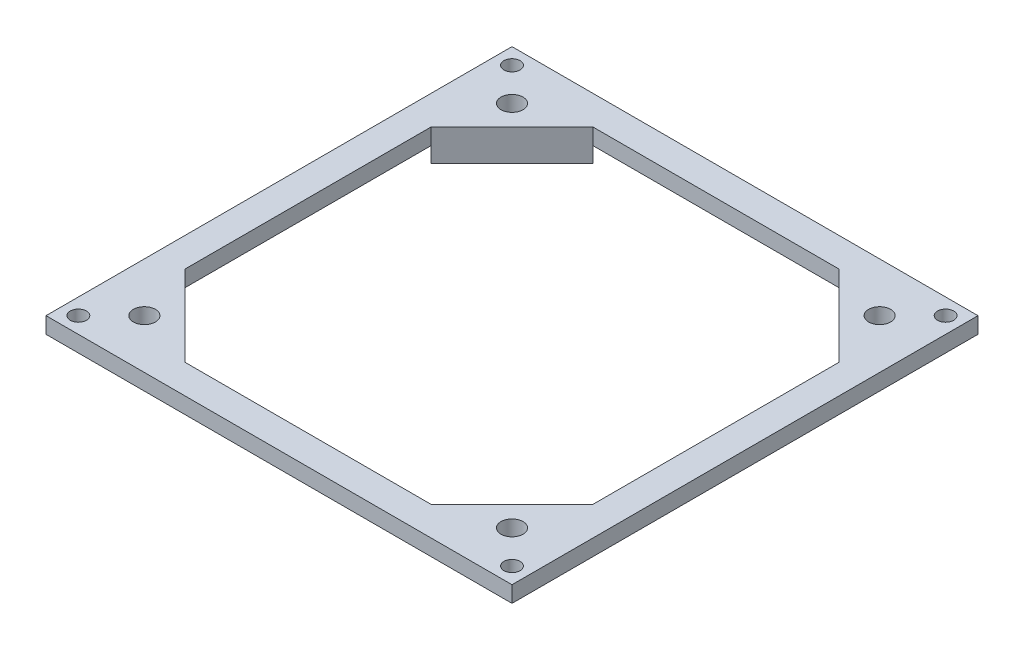
from build123d import *

# Parameters (mm, degrees)
SKETCH1_W           = 91.44
SKETCH1_H           = 91.44
BOSS_EXTRUDE1_DEPTH = 3.175
SKETCH2_W           = 80.01
SKETCH2_H           = 80.01
BOSS_EXTRUDE2_DEPTH = 3.048
CUT_EXTRUDE1_DEPTH  = 65.956620363
SKETCH4_R           = 2.159
CUT_EXTRUDE2_DEPTH  = 65.956620363
FILLET1_R           = 2.54
SKETCH5_R           = 1.5875
CUT_EXTRUDE3_DEPTH  = 65.956620363


with BuildPart() as part:
    # Sketch1 → Boss-Extrude1 (new body)
    with BuildSketch(Plane(origin=(0, 0, 0), x_dir=(1, 0, 0), z_dir=(0, 1, 0))):
        Rectangle(SKETCH1_W, SKETCH1_H)
    extrude(amount=BOSS_EXTRUDE1_DEPTH)

    # Sketch2 → Boss-Extrude2 (add)
    with BuildSketch(Plane.XZ):
        Rectangle(SKETCH2_W, SKETCH2_H)
    extrude(amount=BOSS_EXTRUDE2_DEPTH)

    # Sketch3 → Cut-Extrude1 (cut, through all)
    with BuildSketch(Plane.XZ.offset(3.048)):
        Polygon((-24.13, 40.005), (-40.005, 24.13), (-40.005, -24.13), (-24.13, -40.005), (24.13, -40.005), (40.005, -24.13), (40.005, 24.13), (24.13, 40.005), align=None)
    extrude(amount=-CUT_EXTRUDE1_DEPTH, mode=Mode.SUBTRACT)

    # Sketch4 → Cut-Extrude2 (cut, through all)
    with BuildSketch(Plane.XZ.offset(3.048)):
        with Locations(Location((-36.068, 36.068, 0), (0, 0, 270))):
            Circle(SKETCH4_R)
        with Locations(Location((36.068, 36.068, 0), (0, 0, 270))):
            Circle(SKETCH4_R)
        with Locations(Location((36.068, -36.068, 0), (0, 0, 270))):
            Circle(SKETCH4_R)
        with Locations(Location((-36.068, -36.068, 0), (0, 0, 270))):
            Circle(SKETCH4_R)
    extrude(amount=-CUT_EXTRUDE2_DEPTH, mode=Mode.SUBTRACT)

    # Fillet1
    fillet1_edges = [part.edges().sort_by_distance(p)[0] for p in [
        (40.005, -1.524, -40.005),
        (40.005, -1.524, 40.005),
        (-40.005, -1.524, 40.005),
        (-40.005, -1.524, -40.005),
    ]]
    fillet(fillet1_edges, radius=FILLET1_R)

    # Sketch5 → Cut-Extrude3 (cut, through all)
    with BuildSketch(Plane(origin=(0, 3.175, 0), x_dir=(1, 0, 0), z_dir=(0, 1, 0))):
        with Locations(Location((-42.545, 42.545, 0), (0, 0, 270))):
            Circle(SKETCH5_R)
        with Locations(Location((42.545, 42.545, 0), (0, 0, 270))):
            Circle(SKETCH5_R)
        with Locations(Location((42.545, -42.545, 0), (0, 0, 270))):
            Circle(SKETCH5_R)
        with Locations(Location((-42.545, -42.545, 0), (0, 0, 270))):
            Circle(SKETCH5_R)
    extrude(amount=-CUT_EXTRUDE3_DEPTH, mode=Mode.SUBTRACT)


solid = part.part
